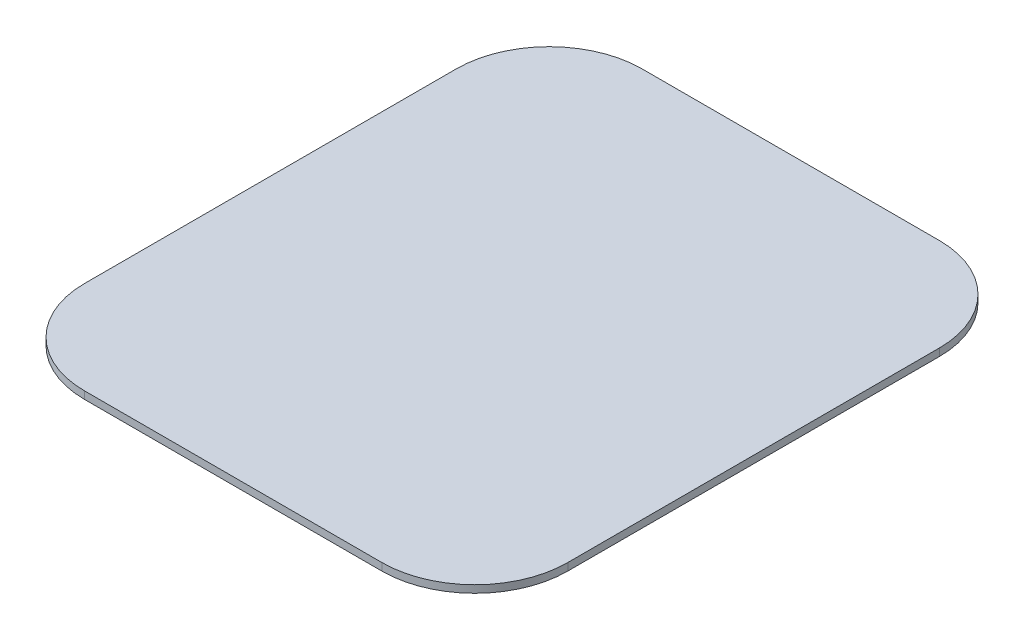
from build123d import *

# Parameters (mm, degrees)
CHAPAINFERIOR_DEPTH = 4


with BuildPart() as part:
    # Chapa inferior → ChapaInferior (new, symmetric)
    with BuildSketch(Plane(origin=(0, 0, 0), x_dir=(1, 0, 0), z_dir=(0, 1, 0))):
        with BuildLine():
            Line((-160, 300), (160, 300))
            ThreePointArc((160, 300), (230.710678119, 270.710678119), (260, 200))
            Line((260, 200), (260, -200))
            ThreePointArc((260, -200), (230.710678119, -270.710678119), (160, -300))
            Line((160, -300), (-160, -300))
            ThreePointArc((-160, -300), (-230.710678119, -270.710678119), (-260, -200))
            Line((-260, -200), (-260, 200))
            ThreePointArc((-260, 200), (-230.710678119, 270.710678119), (-160, 300))
        make_face()
    extrude(amount=CHAPAINFERIOR_DEPTH, both=True)


solid = part.part
